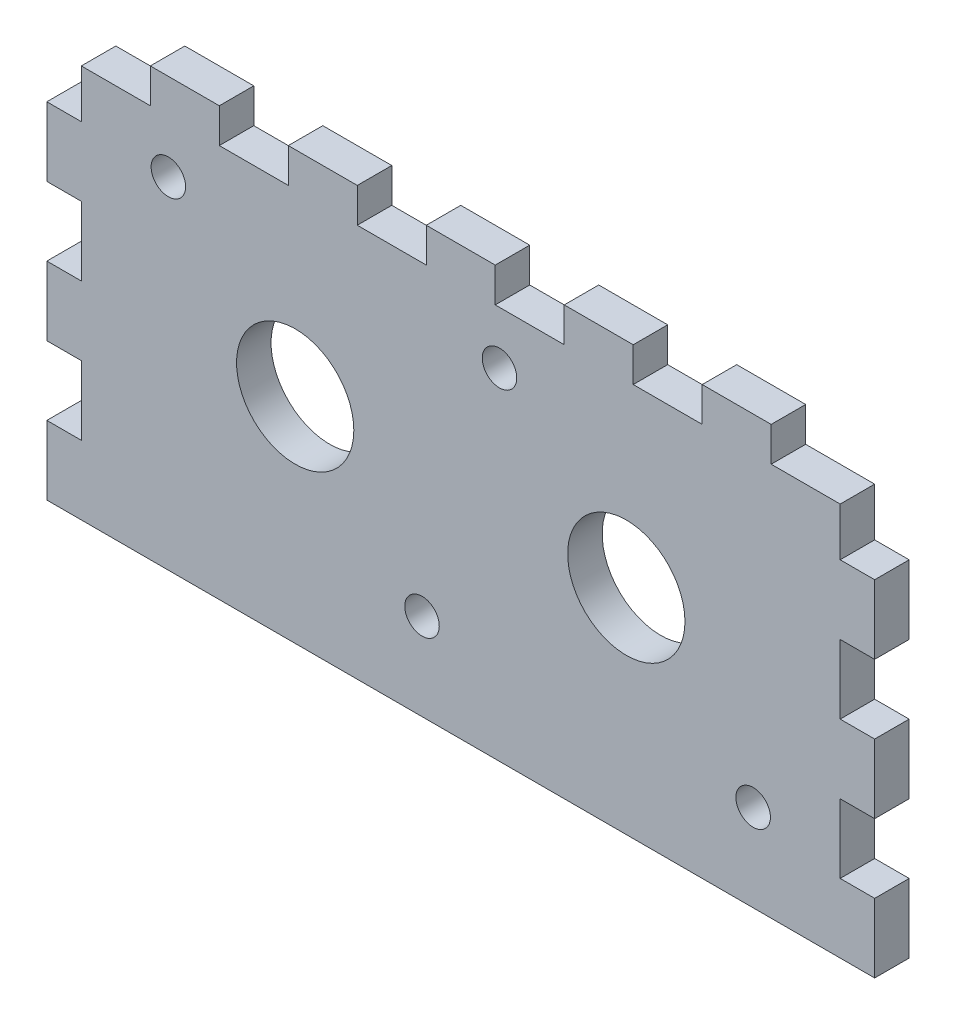
from build123d import *

# Parameters (mm, degrees)
SKETCH_1_W               = 110
SKETCH_1_H               = 57
SKETCH_1_R               = 8.5
SKETCH_1_R_2             = 2.5
EXTRUDE_1_DEPTH          = 5
SKETCH_2_W               = 5
SKETCH_2_H               = 10
EXTRUDE_2_DEPTH          = 5
PATTERN_LINEAR_1_COUNT   = 3
PATTERN_LINEAR_1_PITCH   = 20
MIRROR_1_COPY_1_SKETCH_W = 5
MIRROR_1_COPY_1_SKETCH_H = 10
MIRROR_1_COPY_1_DEPTH    = 5
MIRROR_1_COPY_2_SKETCH_W = 5
MIRROR_1_COPY_2_SKETCH_H = 10
MIRROR_1_COPY_2_DEPTH    = 5
SKETCH_3_W               = 10
SKETCH_3_H               = 5
EXTRUDE_3_DEPTH          = 5
PATTERN_LINEAR_2_COUNT   = 3
PATTERN_LINEAR_2_PITCH   = 20
PATTERN_LINEAR_3_COUNT   = 3
PATTERN_LINEAR_3_PITCH   = 20


with BuildPart() as part:
    # 스케치1 → 보스-돌출1 (new body)
    with BuildSketch(Plane.XY):
        Rectangle(SKETCH_1_W, SKETCH_1_H)
        with Locations((24, 2.5)):
            Circle(SKETCH_1_R, mode=Mode.SUBTRACT)
        with Locations((-24, 2.5)):
            Circle(SKETCH_1_R, mode=Mode.SUBTRACT)
        with Locations((-42.384776311, 20.884776311)):
            Circle(SKETCH_1_R_2, mode=Mode.SUBTRACT)
        with Locations((-5.615223689, -15.884776311)):
            Circle(SKETCH_1_R_2, mode=Mode.SUBTRACT)
        with Locations((5.615223689, 20.884776311)):
            Circle(SKETCH_1_R_2, mode=Mode.SUBTRACT)
        with Locations((42.384776311, -15.884776311)):
            Circle(SKETCH_1_R_2, mode=Mode.SUBTRACT)
    extrude(amount=EXTRUDE_1_DEPTH)

    # 스케치2 → 보스-돌출2 (add)
    with BuildSketch(Plane.XY.offset(5)):
        with Locations((57.5, -23.5)):
            Rectangle(SKETCH_2_W, SKETCH_2_H)
    extrude_2 = extrude(amount=-EXTRUDE_2_DEPTH)

    # 선형 패턴1: 보스-돌출2 ×3
    with Locations(*[(0, i * PATTERN_LINEAR_1_PITCH, 0) for i in range(1, PATTERN_LINEAR_1_COUNT)]):
        add(extrude_2)

    # 대칭 복사1: 보스-돌출2 across plane
    add(extrude_2.mirror(Plane(origin=(0, 0, 0), x_dir=(0, 0, 1), z_dir=(1, 0, 0))))

    # 대칭 복사1 copy 1 sketch → 대칭 복사1 copy 1 (add)
    with BuildSketch(Plane(origin=(0, 20, 5), x_dir=(-1, 0, 0), z_dir=(0, 0, 1))):
        with Locations((57.5, 23.5)):
            Rectangle(MIRROR_1_COPY_1_SKETCH_W, MIRROR_1_COPY_1_SKETCH_H)
    extrude(amount=-MIRROR_1_COPY_1_DEPTH)

    # 대칭 복사1 copy 2 sketch → 대칭 복사1 copy 2 (add)
    with BuildSketch(Plane(origin=(0, 40, 5), x_dir=(-1, 0, 0), z_dir=(0, 0, 1))):
        with Locations((57.5, 23.5)):
            Rectangle(MIRROR_1_COPY_2_SKETCH_W, MIRROR_1_COPY_2_SKETCH_H)
    extrude(amount=-MIRROR_1_COPY_2_DEPTH)

    # 스케치3 → 보스-돌출3 (add)
    with BuildSketch(Plane.XY.offset(5)):
        with Locations((0, 31)):
            Rectangle(SKETCH_3_W, SKETCH_3_H)
    extrude_3 = extrude(amount=-EXTRUDE_3_DEPTH)

    # 선형 패턴2: 보스-돌출3 ×3
    with Locations(*[(i * PATTERN_LINEAR_2_PITCH, 0, 0) for i in range(1, PATTERN_LINEAR_2_COUNT)]):
        add(extrude_3)

    # 선형 패턴3: 보스-돌출3 ×3
    with Locations(*[(-i * PATTERN_LINEAR_3_PITCH, 0, 0) for i in range(1, PATTERN_LINEAR_3_COUNT)]):
        add(extrude_3)


solid = part.part
